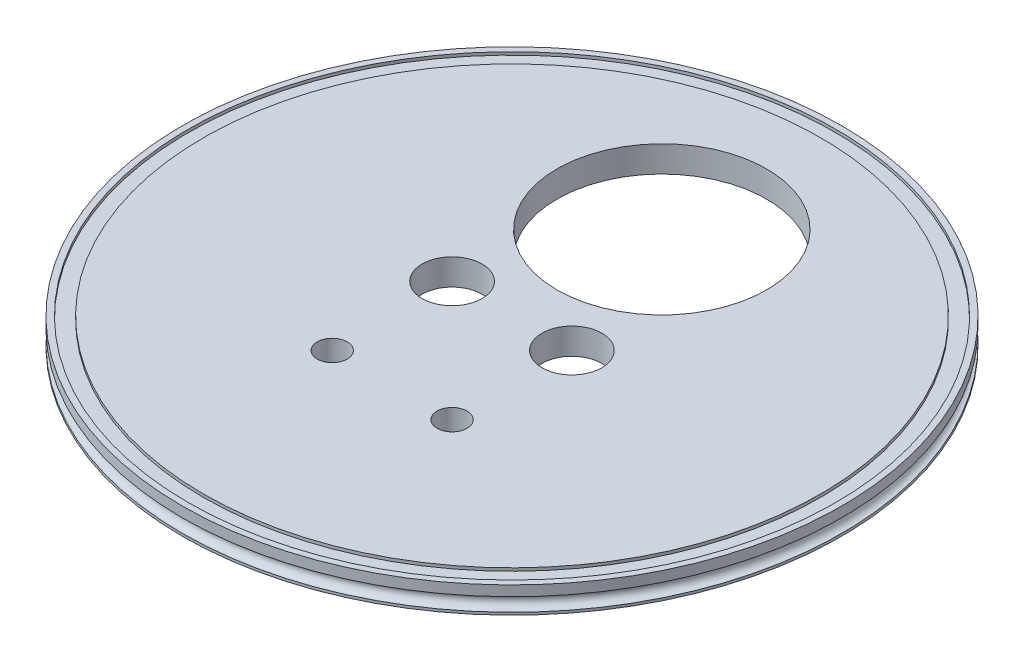
from build123d import *

# Parameters (mm, degrees)
SKETCH2_R          = 6.35
CUT_EXTRUDE1_DEPTH = 198.877910986
SKETCH3_R          = 12.7
CUT_EXTRUDE2_DEPTH = 198.877910986
SKETCH4_R          = 44.45
CUT_EXTRUDE3_DEPTH = 198.877910986


with BuildPart() as part:
    # Sketch1 → Revolve1 (revolve)
    with BuildSketch(Plane.XY, mode=Mode.PRIVATE) as revolve1_sk:
        with BuildLine():
            Line((0, 1.364957177), (0, -9.747542823))
            Line((0, -9.747542823), (120.65, -9.747542823))
            Line((120.65, -9.747542823), (120.65, -7.207542823))
            Line((120.65, -7.207542823), (127, -7.207542823))
            Line((127, -7.207542823), (127, -9.747542823))
            Line((127, -9.747542823), (139.7, -9.747542823))
            Line((139.7, -9.747542823), (139.7, -8.668042823))
            ThreePointArc((139.7, -8.668042823), (136.8425, -5.810542823), (139.7, -2.953042823))
            Line((139.7, -2.953042823), (139.7, 1.364957177))
            Line((139.7, 1.364957177), (137.16, 1.364957177))
            Line((137.16, 1.364957177), (137.16, 0.094957177))
            Line((137.16, 0.094957177), (130.81, 0.094957177))
            Line((130.81, 0.094957177), (130.81, 1.364957177))
            Line((130.81, 1.364957177), (0, 1.364957177))
        make_face()
    revolve(revolve1_sk.sketch.rotate(Axis((0, 12.263795045, 0), (0, -1, 0)), 90), axis=Axis((0, 12.263795045, 0), (0, -1, 0)))

    # Sketch2 → Cut-Extrude1 (cut, through all)
    with BuildSketch(Plane(origin=(0, 1.364957177, 0), x_dir=(1, 0, 0), z_dir=(0, 1, 0))):
        with Locations(Location((25.4, -50.8, 0), (0, 0, 270))):
            Circle(SKETCH2_R)
        with Locations(Location((-25.4, -50.8, 0), (0, 0, 270))):
            Circle(SKETCH2_R)
    extrude(amount=-CUT_EXTRUDE1_DEPTH, mode=Mode.SUBTRACT)

    # Sketch3 → Cut-Extrude2 (cut, through all)
    with BuildSketch(Plane(origin=(0, -9.747542823, 0), x_dir=(-1, 0, 0), z_dir=(0, -1, 0))):
        with Locations(Location((-25.4, 0, 0), (0, 0, 90))):
            Circle(SKETCH3_R)
        with Locations(Location((25.4, 0, 0), (0, 0, 90))):
            Circle(SKETCH3_R)
    extrude(amount=-CUT_EXTRUDE2_DEPTH, mode=Mode.SUBTRACT)

    # Sketch4 → Cut-Extrude3 (cut, through all)
    with BuildSketch(Plane(origin=(0, 1.364957177, 0), x_dir=(1, 0, 0), z_dir=(0, 1, 0))):
        with Locations(Location((0, 63.5, 0), (0, 0, 270))):
            Circle(SKETCH4_R)
    extrude(amount=-CUT_EXTRUDE3_DEPTH, mode=Mode.SUBTRACT)


solid = part.part
